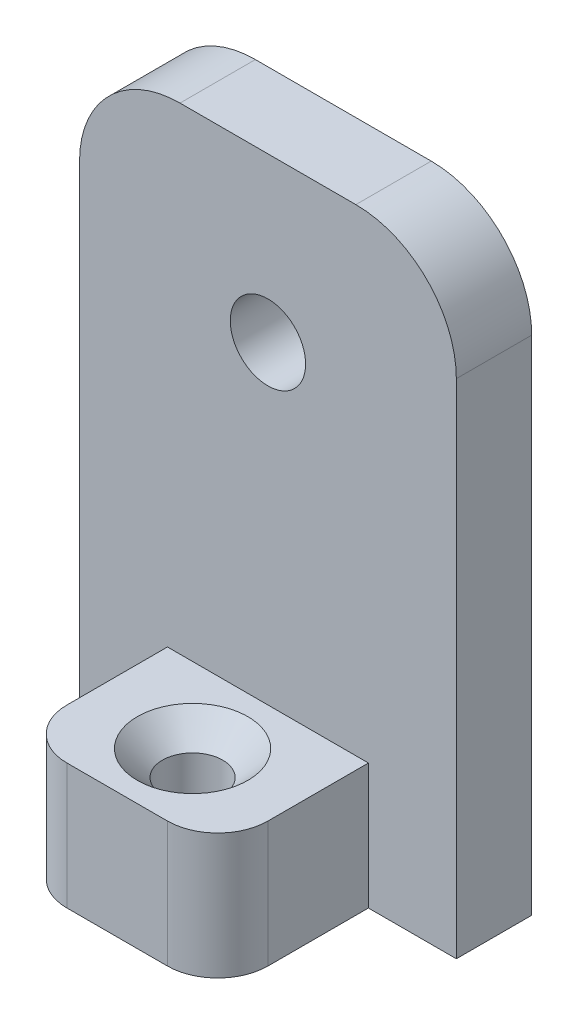
from build123d import *

# Parameters (mm, degrees)
SKETCH1_W                                       = 15
SKETCH1_H                                       = 24
BOSS_EXTRUDE1_DEPTH                             = 3
SKETCH2_W                                       = 8
SKETCH2_H                                       = 5
BOSS_EXTRUDE2_DEPTH                             = 6
CSK_FOR_M2_FLAT_HEAD_MACHINE_SCREW1_D           = 2.4
CSK_FOR_M2_FLAT_HEAD_MACHINE_SCREW1_CSINK_D     = 4.4
CSK_FOR_M2_FLAT_HEAD_MACHINE_SCREW1_CSINK_ANGLE = 90
FILLET1_R                                       = 2
SKETCH5_R                                       = 1.5
CUT_EXTRUDE1_DEPTH                              = 3
FILLET2_R                                       = 4


with BuildPart() as part:
    # Sketch1 → Boss-Extrude1 (new body)
    with BuildSketch(Plane.XY):
        Rectangle(SKETCH1_W, SKETCH1_H)
    extrude(amount=BOSS_EXTRUDE1_DEPTH)

    # Sketch2 → Boss-Extrude2 (add)
    with BuildSketch(Plane.XY.offset(3)):
        with Locations((0, -9.5)):
            Rectangle(SKETCH2_W, SKETCH2_H)
    extrude(amount=BOSS_EXTRUDE2_DEPTH)

    # CSK for M2 Flat Head Machine Screw1 (through all)
    with Locations(Plane(origin=(0, -7, 6), x_dir=(0, 0, 1), z_dir=(0, 1, 0))):
        with Locations((0, 0)):
            CounterSinkHole(CSK_FOR_M2_FLAT_HEAD_MACHINE_SCREW1_D / 2, CSK_FOR_M2_FLAT_HEAD_MACHINE_SCREW1_CSINK_D / 2, counter_sink_angle=CSK_FOR_M2_FLAT_HEAD_MACHINE_SCREW1_CSINK_ANGLE)

    # Fillet1
    fillet1_edges = [part.edges().sort_by_distance(p)[0] for p in [
        (-4, -9.5, 9),
        (4, -9.5, 9),
    ]]
    fillet(fillet1_edges, radius=FILLET1_R)

    # Sketch5 → Cut-Extrude1 (cut)
    with BuildSketch(Plane(origin=(0, 0, 0), x_dir=(-1, 0, 0), z_dir=(0, 0, -1))):
        with Locations((0, 5.5)):
            Circle(SKETCH5_R)
    extrude(amount=-CUT_EXTRUDE1_DEPTH, mode=Mode.SUBTRACT)

    # Fillet2
    fillet2_edges = [part.edges().sort_by_distance(p)[0] for p in [
        (-7.5, 12, 1.5),
        (7.5, 12, 1.5),
    ]]
    fillet(fillet2_edges, radius=FILLET2_R)


solid = part.part
